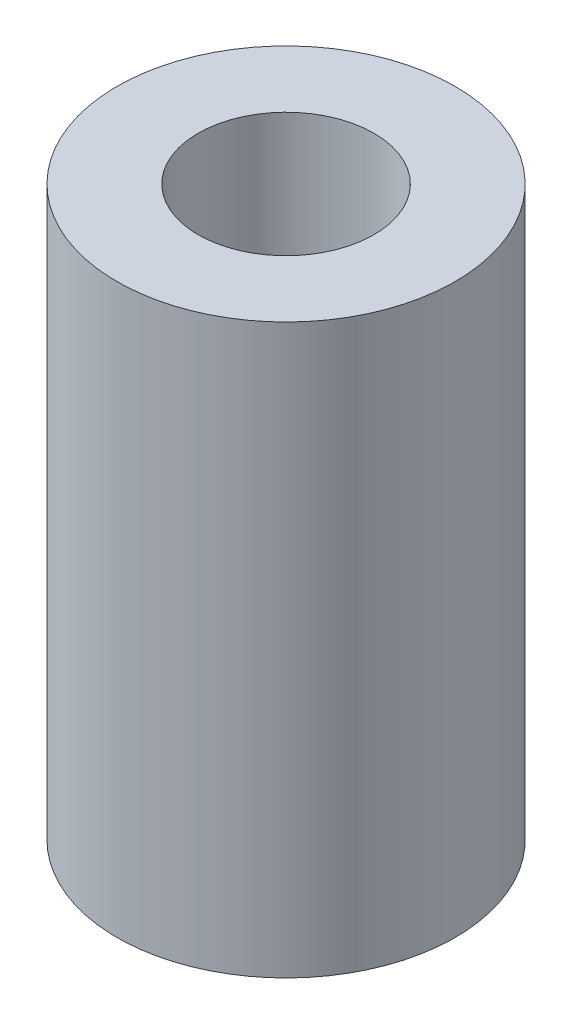
from build123d import *

# Parameters (mm, degrees)
SKETCH1_R           = 6.25
SKETCH1_R_2         = 3.25
BOSS_EXTRUDE1_DEPTH = 21


with BuildPart() as part:
    # Sketch1 → Boss-Extrude1 (new body)
    with BuildSketch(Plane(origin=(0, 0, 0), x_dir=(1, 0, 0), z_dir=(0, 1, 0))):
        with Locations(Location((0, 0, 0), (0, 0, 90))):
            Circle(SKETCH1_R)
        with Locations(Location((0, 0, 0), (0, 0, 90))):
            Circle(SKETCH1_R_2, mode=Mode.SUBTRACT)
    extrude(amount=BOSS_EXTRUDE1_DEPTH)


solid = part.part
